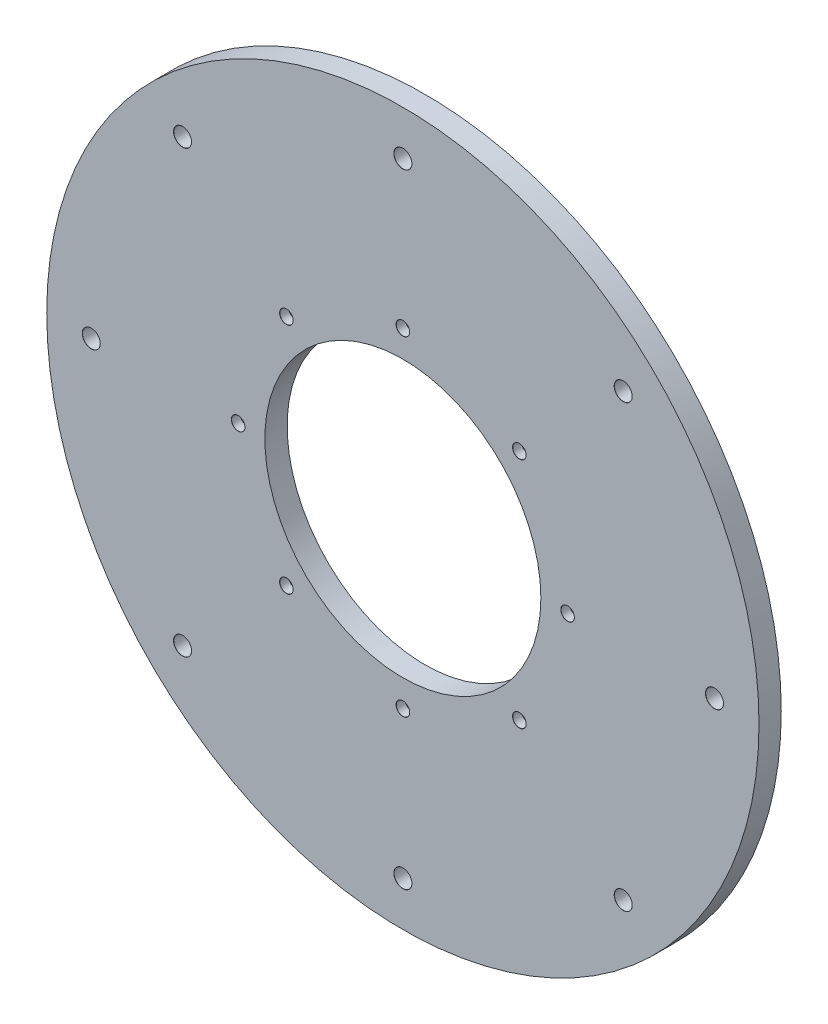
from build123d import *

# Parameters (mm, degrees)
SKETCH2_R                       = 80
SKETCH2_R_2                     = 31
BOSS_EXTRUDE1_DEPTH             = 5
F_4_0MM_DOWEL_HOLE1_D           = 4
F_4_0MM_DOWEL_HOLE1_CSINK_D     = 4.05
F_4_0MM_DOWEL_HOLE1_CSINK_ANGLE = 90
F_3_0MM_DOWEL_HOLE1_D           = 3
F_3_0MM_DOWEL_HOLE1_CSINK_D     = 3.05
F_3_0MM_DOWEL_HOLE1_CSINK_ANGLE = 90
SKETCH13_R                      = 5
CUT_EXTRUDE1_DEPTH              = 3


with BuildPart() as part:
    # Sketch2 → Boss-Extrude1 (new body)
    with BuildSketch(Plane.XY):
        Circle(SKETCH2_R)
        Circle(SKETCH2_R_2, mode=Mode.SUBTRACT)
    extrude(amount=BOSS_EXTRUDE1_DEPTH)

    # Ø4.0mm Dowel Hole1 (through all)
    with Locations(Plane.XY.offset(5)):
        with Locations((0, 70), (-49.497474683, 49.497474683), (-70, 0), (-49.497474683, -49.497474683), (0, -70), (49.497474683, -49.497474683), (70, 0), (49.497474683, 49.497474683)):
            CounterSinkHole(F_4_0MM_DOWEL_HOLE1_D / 2, F_4_0MM_DOWEL_HOLE1_CSINK_D / 2, counter_sink_angle=F_4_0MM_DOWEL_HOLE1_CSINK_ANGLE)

    # Ø3.0mm Dowel Hole1 (through all)
    with Locations(Plane.XY.offset(5)):
        with Locations((0, 37), (-26.162950904, 26.162950904), (-37, 0), (-26.162950904, -26.162950904), (0, -37), (26.162950904, -26.162950904), (37, 0), (26.162950904, 26.162950904)):
            CounterSinkHole(F_3_0MM_DOWEL_HOLE1_D / 2, F_3_0MM_DOWEL_HOLE1_CSINK_D / 2, counter_sink_angle=F_3_0MM_DOWEL_HOLE1_CSINK_ANGLE)

    # Sketch13 → Cut-Extrude1 (cut)
    with BuildSketch(Plane.XY):
        with Locations((0, 37)):
            Circle(SKETCH13_R)
        with Locations((26.162950904, 26.162950904)):
            Circle(SKETCH13_R)
        with Locations((37, 0)):
            Circle(SKETCH13_R)
        with Locations((26.162950904, -26.162950904)):
            Circle(SKETCH13_R)
        with Locations((0, -37)):
            Circle(SKETCH13_R)
        with Locations((-26.162950904, -26.162950904)):
            Circle(SKETCH13_R)
        with Locations((-37, 0)):
            Circle(SKETCH13_R)
        with Locations((-26.162950904, 26.162950904)):
            Circle(SKETCH13_R)
    extrude(amount=CUT_EXTRUDE1_DEPTH, mode=Mode.SUBTRACT)


solid = part.part
